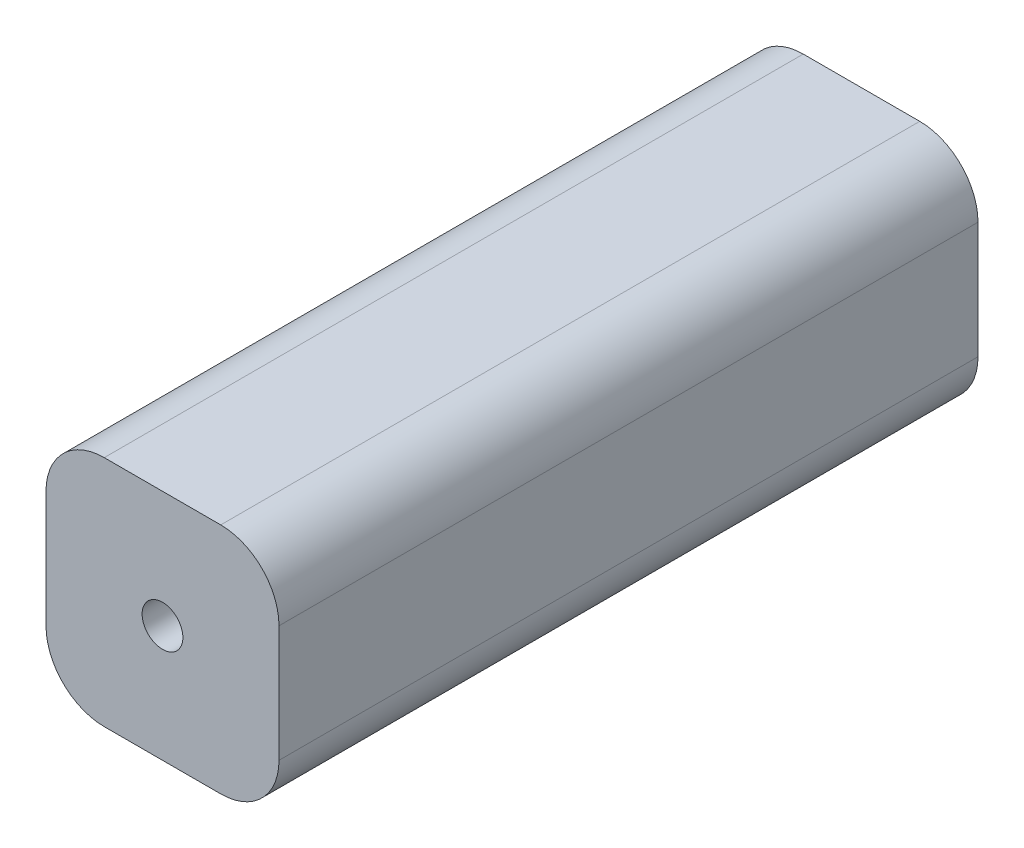
from build123d import *

# Parameters (mm, degrees)
ESQUISSE1_W             = 20
ESQUISSE1_H             = 20
BOSS_EXTRU_1_DEPTH      = 60
ESQUISSE2_R             = 1.75
ENL_V_MAT_EXTRU_1_DEPTH = 15
ENL_V_START             = -15
ESQUISSE3_R             = 1.75
ENL_V_MAT_EXTRU_2_DEPTH = 15
CONG_1_R                = 5


with BuildPart() as part:
    # Esquisse1 → Boss.-Extru.1 (new body)
    with BuildSketch(Plane.XY):
        with Locations((-10, 10)):
            Rectangle(ESQUISSE1_W, ESQUISSE1_H)
    extrude(amount=BOSS_EXTRU_1_DEPTH)

    # Esquisse2 → Enlèv. mat.-Extru.1 (cut)
    with BuildSketch(Plane.XY.offset(60)):
        with Locations((-10, 10)):
            Circle(ESQUISSE2_R)
    extrude(amount=-ENL_V_MAT_EXTRU_1_DEPTH, mode=Mode.SUBTRACT)

    # Esquisse3 → Enlèv. mat.-Extru.2 (cut)
    with BuildSketch(Plane(origin=(0, 0, 0), x_dir=(-1, 0, 0), z_dir=(0, 0, -1)).offset(ENL_V_START)):
        with Locations(Location((10, 10, 0), (0, 0, 180))):
            Circle(ESQUISSE3_R)
    extrude(amount=ENL_V_MAT_EXTRU_2_DEPTH, mode=Mode.SUBTRACT)

    # Congé1
    cong_1_edges = [part.edges().sort_by_distance(p)[0] for p in [
        (0, 0, 30),
        (-20, 0, 30),
        (-20, 20, 30),
        (0, 20, 30),
    ]]
    fillet(cong_1_edges, radius=CONG_1_R)


solid = part.part
